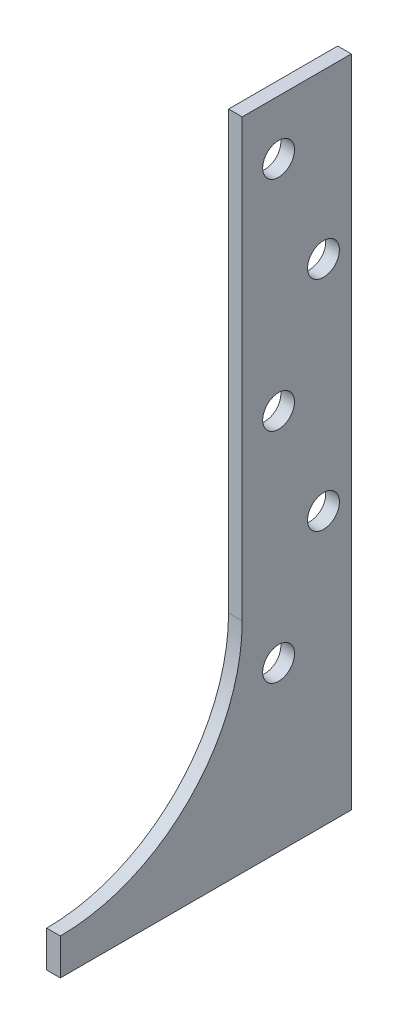
from build123d import *

# Parameters (mm, degrees)
SKETCH1_R           = 22.225
BOSS_EXTRUDE1_DEPTH = 19.05


with BuildPart() as part:
    # Sketch1 → Boss-Extrude1 (new body)
    with BuildSketch(Plane(origin=(0, 0, 0), x_dir=(0, 0, -1), z_dir=(1, 0, 0))):
        with BuildLine():
            Line((-152.4, 914.4), (-152.4, 304.8))
            ThreePointArc((-152.4, 304.8), (-226.794877579, 125.194877579), (-406.4, 50.8))
            Line((-406.4, 50.8), (-406.4, 0))
            Line((-406.4, 0), (0, 0))
            Line((0, 0), (0, 914.4))
            Line((0, 914.4), (-152.4, 914.4))
        make_face()
        with Locations(Location((-101.6, 838.2, 0), (0, 0, 180))):
            Circle(SKETCH1_R, mode=Mode.SUBTRACT)
        with Locations(Location((-38.873826797, 685.8, 0), (0, 0, 180))):
            Circle(SKETCH1_R, mode=Mode.SUBTRACT)
        with Locations(Location((-101.6, 533.4, 0), (0, 0, 180))):
            Circle(SKETCH1_R, mode=Mode.SUBTRACT)
        with Locations(Location((-38.873826797, 381, 0), (0, 0, 180))):
            Circle(SKETCH1_R, mode=Mode.SUBTRACT)
        with Locations(Location((-101.6, 228.6, 0), (0, 0, 180))):
            Circle(SKETCH1_R, mode=Mode.SUBTRACT)
    extrude(amount=BOSS_EXTRUDE1_DEPTH)


solid = part.part
